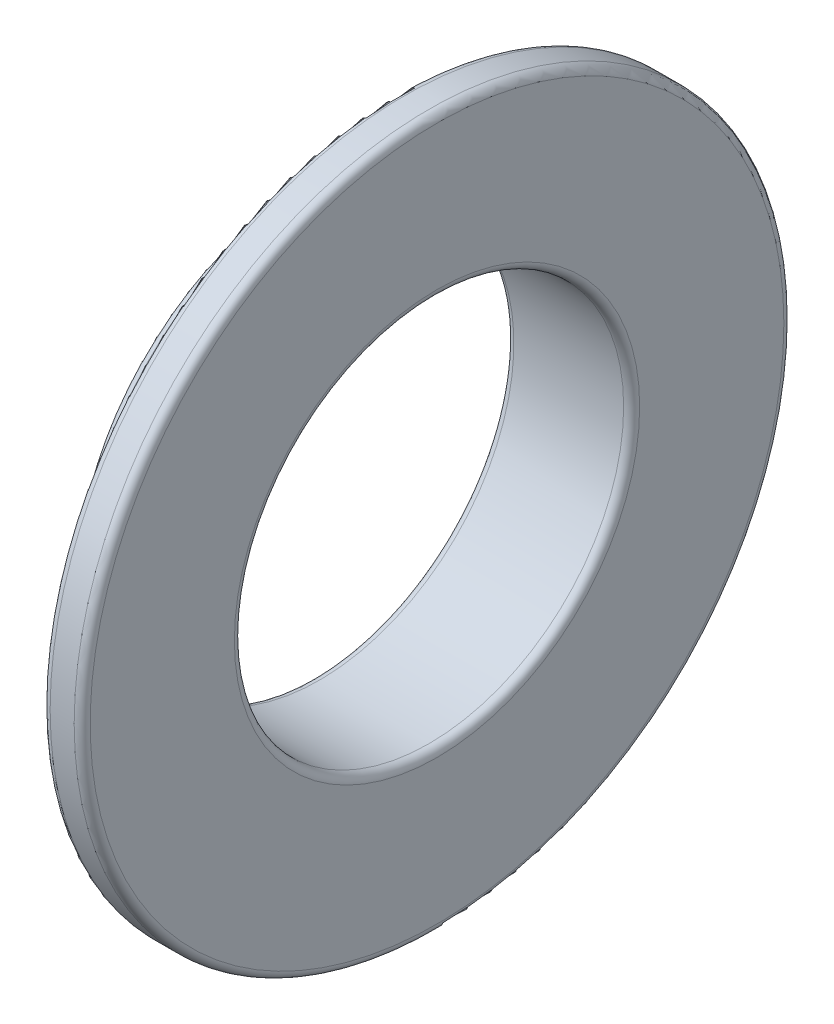
from build123d import *

# Parameters (mm, degrees)
FILLET1_R = 0.5


with BuildPart() as part:
    # Sketch1 → Revolve1 (revolve)
    with BuildSketch(Plane.XY, mode=Mode.PRIVATE) as revolve1_sk:
        Polygon((12.5, 22.15), (10, 22.15), (10, 17.15), (10, 14.95), (4.65, 14.95), (4.65, 12.15), (12.5, 12.15), align=None)
    revolve(revolve1_sk.sketch.rotate(Axis((-30.849638619, 0, 0), (1, 0, 0)), 90), axis=Axis((-30.849638619, 0, 0), (1, 0, 0)))

    # Fillet1
    fillet1_edges = [part.edges().sort_by_distance(p)[0] for p in [
        (10, 0, -22.15),
        (12.5, 0, -22.15),
        (12.5, 0, -12.15),
        (4.65, 0, -12.15),
        (4.65, 0, -14.95),
        (10, 0, -14.95),
    ]]
    fillet(fillet1_edges, radius=FILLET1_R)


solid = part.part
